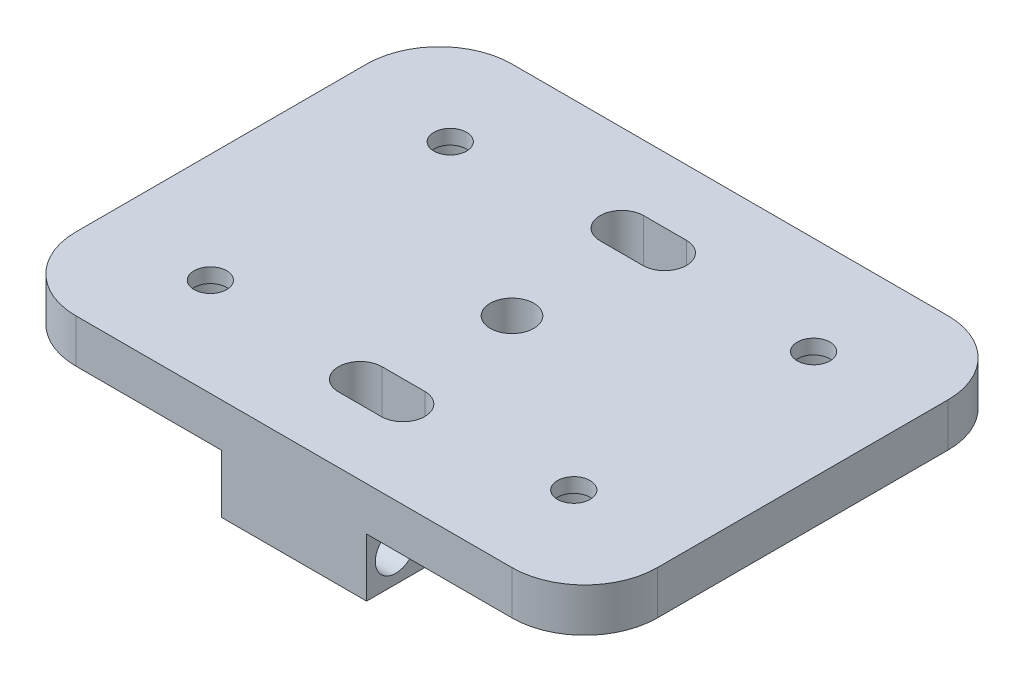
from build123d import *
from build123d.topology import SkipClean

# Parameters (mm, degrees)
ESQUISSE1_R              = 2.25
ESQUISSE1_R_2            = 3
BOSS_EXTRU_3_DEPTH       = 6
BOSS_EXTRU_4_START       = 8
ESQUISSE2_W              = 20
ESQUISSE2_H              = 60
ESQUISSE2_R              = 3
BOSS_EXTRU_4_DEPTH       = 8
ESQUISSE3_R              = 4
ENL_V_MAT_EXTRU_2_DEPTH  = 4
ESQUISSE7_R              = 2.8
ENL_V_MAT_EXTRU_8_DEPTH  = 8.1
ENL_V_MAT_EXTRU_9_DEPTH  = 52.923019943
ESQUISSE9_R              = 2.8
ENL_V_MAT_EXTRU_10_DEPTH = 8.1


with BuildPart() as part:
    # Esquisse1 → Boss.-Extru.3 (new body)
    with BuildSketch(Plane(origin=(0, 0, 0), x_dir=(1, 0, 0), z_dir=(0, 1, 0))):
        with BuildLine():
            Line((-29.104707822, 30), (-30, 30))
            ThreePointArc((-30, 30), (-37.071067812, 27.071067812), (-40, 20))
            Line((-40, 20), (-40, -20))
            ThreePointArc((-40, -20), (-37.071067812, -27.071067812), (-30, -30))
            Line((-30, -30), (-29.104707822, -30))
            Line((-29.104707822, -30), (-9.104707822, -30))
            Line((-9.104707822, -30), (30, -30))
            ThreePointArc((30, -30), (37.071067812, -27.071067812), (40, -20))
            Line((40, -20), (40, 20))
            ThreePointArc((40, 20), (37.071067812, 27.071067812), (30, 30))
            Line((30, 30), (-9.104707822, 30))
            Line((-9.104707822, 30), (-29.104707822, 30))
        make_face()
        with Locations(Location((-25, -16.5, 0), (0, 0, 270))):
            Circle(ESQUISSE1_R, mode=Mode.SUBTRACT)
        with Locations(Location((25, -16.5, 0), (0, 0, 270))):
            Circle(ESQUISSE1_R, mode=Mode.SUBTRACT)
        with Locations(Location((0, 0, 0), (0, 0, 270))):
            Circle(ESQUISSE1_R_2, mode=Mode.SUBTRACT)
        with Locations(Location((-25, 16.5, 0), (0, 0, 270))):
            Circle(ESQUISSE1_R, mode=Mode.SUBTRACT)
        with Locations(Location((25, 16.5, 0), (0, 0, 270))):
            Circle(ESQUISSE1_R, mode=Mode.SUBTRACT)
    extrude(amount=BOSS_EXTRU_3_DEPTH)

    # Esquisse2 → Boss.-Extru.4 (add)
    with SkipClean():  # the faces are left unmerged after this step: merging them gives an invalid solid
        with BuildSketch(Plane.XZ.offset(BOSS_EXTRU_4_START)):
            Rectangle(ESQUISSE2_W, ESQUISSE2_H)
            with Locations(Location((0, 0, 0), (0, 0, 270))):
                Circle(ESQUISSE2_R, mode=Mode.SUBTRACT)
        extrude(amount=-BOSS_EXTRU_4_DEPTH)

    # Esquisse3 → Enlèv. mat.-Extru.2 (cut)
    with SkipClean():  # the faces are left unmerged after this step: merging them gives an invalid solid
        with BuildSketch(Plane.XZ):
            with Locations(Location((-25, 16.5, 0), (0, 0, 270))):
                Circle(ESQUISSE3_R)
            with Locations(Location((25, 16.5, 0), (0, 0, 270))):
                Circle(ESQUISSE3_R)
            with Locations(Location((25, -16.5, 0), (0, 0, 270))):
                Circle(ESQUISSE3_R)
            with Locations(Location((-25, -16.5, 0), (0, 0, 270))):
                Circle(ESQUISSE3_R)
        extrude(amount=-ENL_V_MAT_EXTRU_2_DEPTH, mode=Mode.SUBTRACT)

    # Esquisse7 → Enlèv. mat.-Extru.8 (cut)
    with SkipClean():  # the faces are left unmerged after this step: merging them gives an invalid solid
        with BuildSketch(Plane.ZY.offset(10)):
            with Locations((26, -3.87740141)):
                Circle(ESQUISSE7_R)
            with Locations((-26, -3.87740141)):
                Circle(ESQUISSE7_R)
        extrude(amount=-ENL_V_MAT_EXTRU_8_DEPTH, mode=Mode.SUBTRACT)

    # Esquisse8 → Enlèv. mat.-Extru.9 (cut, through all)
    with SkipClean():  # the faces are left unmerged after this step: merging them gives an invalid solid
        with BuildSketch(Plane.XZ.offset(8)):
            with BuildLine():
                Line((-2.879526134, 21), (3, 21))
                ThreePointArc((3, 21), (6, 18), (3, 15))
                Line((3, 15), (-2.879526134, 15))
                ThreePointArc((-2.879526134, 15), (-5.879526134, 18), (-2.879526134, 21))
            make_face()
            with BuildLine():
                Line((-2.879526134, -15), (3, -15))
                ThreePointArc((3, -15), (6, -18), (3, -21))
                Line((3, -21), (-2.879526134, -21))
                ThreePointArc((-2.879526134, -21), (-5.879526134, -18), (-2.879526134, -15))
            make_face()
        extrude(amount=-ENL_V_MAT_EXTRU_9_DEPTH, mode=Mode.SUBTRACT)

    # Esquisse9 → Enlèv. mat.-Extru.10 (cut)
    with SkipClean():  # the faces are left unmerged after this step: merging them gives an invalid solid
        with BuildSketch(Plane(origin=(10, 0, 0), x_dir=(0, 0, -1), z_dir=(1, 0, 0))):
            with Locations((-26, -3.88)):
                Circle(ESQUISSE9_R)
            with Locations((26, -3.88)):
                Circle(ESQUISSE9_R)
        extrude(amount=-ENL_V_MAT_EXTRU_10_DEPTH, mode=Mode.SUBTRACT)


solid = part.part
